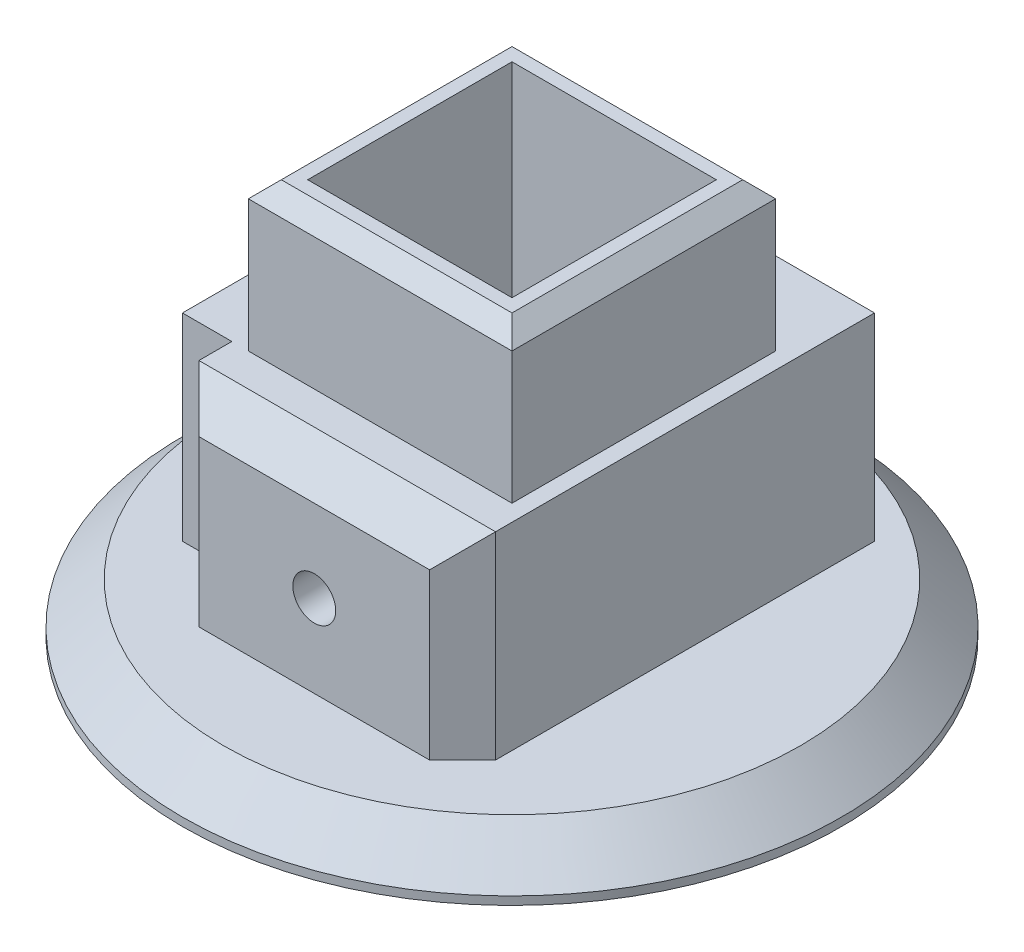
from build123d import *

# Parameters (mm, degrees)
SKETCH1_W               = 16
SKETCH1_H               = 16
BOSS_EXTRUDE1_DEPTH     = 24
SKETCH12_W              = 12.4
SKETCH12_H              = 12.4
CUT_EXTRUDE6_DEPTH      = 22
SKETCH13_R              = 20
BOSS_EXTRUDE2_DEPTH     = 3
CHAMFER1_SIZE           = 2.5
SKETCH14_W              = 16
SKETCH14_H              = 16
BOSS_EXTRUDE3_DEPTH     = 12
CUT_EXTRUDE1_DEPTH      = 7.5
CUT_EXTRUDE5_DEPTH      = 6.3
CUT_EXTRUDE5_DEPTH_BACK = 0.1
SKETCH11_W              = 4.2
SKETCH11_H              = 5.5
CHAMFER2_SIZE           = 2
CHAMFER4_SIZE           = 2
SKETCH15_R              = 1.3
CUT_EXTRUDE7_DEPTH      = 42.620307543
CHAMFER5_SIZE           = 1
ESQUISSE3_W             = 15.926523834
ESQUISSE3_H             = 12
BOSS_EXTRU_1_DEPTH      = 5
ENL_V_MAT_EXTRU_1_DEPTH = 7
ESQUISSE5_R             = 1.3
ENL_V_MAT_EXTRU_2_DEPTH = 5
CHANFREIN2_SIZE         = 2
CHANFREIN3_SIZE         = 2
CHANFREIN4_SIZE         = 2


with BuildPart() as part:
    # Sketch1 → Boss-Extrude1 (new body)
    with BuildSketch(Plane(origin=(0, 0, 0), x_dir=(1, 0, 0), z_dir=(0, 1, 0))):
        with Locations((0, 8)):
            Rectangle(SKETCH1_W, SKETCH1_H)
    extrude(amount=BOSS_EXTRUDE1_DEPTH)

    # Sketch12 → Cut-Extrude6 (cut)
    with BuildSketch(Plane(origin=(0, 24, 0), x_dir=(1, 0, 0), z_dir=(0, 1, 0))):
        with Locations((0, 8)):
            Rectangle(SKETCH12_W, SKETCH12_H)
    extrude(amount=-CUT_EXTRUDE6_DEPTH, mode=Mode.SUBTRACT)

    # Sketch13 → Boss-Extrude2 (add)
    with BuildSketch(Plane(origin=(0, 0, 0), x_dir=(1, 0, 0), z_dir=(0, 1, 0))):
        with Locations(Location((0, 8, 0), (0, 0, 270))):
            Circle(SKETCH13_R)
    extrude(amount=BOSS_EXTRUDE2_DEPTH)

    # Chamfer1
    chamfer1_edges = [part.edges().sort_by_distance(p)[0] for p in [
        (0, 3, -28),
    ]]
    chamfer(chamfer1_edges, length=CHAMFER1_SIZE)

    # Sketch14 → Boss-Extrude3 (add)
    with BuildSketch(Plane(origin=(0, 3, 0), x_dir=(1, 0, 0), z_dir=(0, 1, 0))):
        Polygon((-8, 23), (8, 23), (9, 23), (9, -4), (8, -4), (-8, -4), (-9, -4), (-9, 23), align=None)
        with Locations((0, 8)):
            Rectangle(SKETCH14_W, SKETCH14_H, mode=Mode.SUBTRACT)
    extrude(amount=BOSS_EXTRUDE3_DEPTH)

    # Sketch5 → Cut-Extrude1 (cut)
    with BuildSketch(Plane(origin=(0, 0, -23), x_dir=(-1, 0, 0), z_dir=(0, 0, -1))):
        with BuildLine():
            Line((-2.1, 11.1), (2.1, 11.1))
            Line((2.1, 11.1), (3.1, 10.1))
            Line((3.1, 10.1), (3.1, 8.8))
            ThreePointArc((3.1, 8.8), (3.9, 8), (3.1, 7.2))
            Line((3.1, 7.2), (3.1, 4.9))
            Line((3.1, 4.9), (-3.1, 4.9))
            Line((-3.1, 4.9), (-3.1, 7.2))
            ThreePointArc((-3.1, 7.2), (-3.9, 8), (-3.1, 8.8))
            Line((-3.1, 8.8), (-3.1, 10.1))
            Line((-3.1, 10.1), (-2.1, 11.1))
        make_face()
    extrude(amount=-CUT_EXTRUDE1_DEPTH, mode=Mode.SUBTRACT)

    # Sketch11 → Cut-Extrude5 (cut, two sides: drawn at the far end of the back side and taken through both)
    with BuildSketch(Plane.XZ.offset(-11.1).offset(-CUT_EXTRUDE5_DEPTH_BACK)):
        with Locations((0, -18.25)):
            Rectangle(SKETCH11_W, SKETCH11_H)
    extrude(amount=CUT_EXTRUDE5_DEPTH + CUT_EXTRUDE5_DEPTH_BACK, mode=Mode.SUBTRACT)

    # Chamfer2
    chamfer2_edges = [part.edges().sort_by_distance(p)[0] for p in [
        (0, 15, -23),
        (9, 9, -23),
        (-9, 9, -23),
    ]]
    chamfer(chamfer2_edges, length=CHAMFER2_SIZE)

    # Chamfer4
    chamfer4_edges = [part.edges().sort_by_distance(p)[0] for p in [
        (0, 15, 4),
        (-9, 9, 4),
        (9, 9, 4),
    ]]
    chamfer(chamfer4_edges, length=CHAMFER4_SIZE)

    # Sketch15 → Cut-Extrude7 (cut, through all)
    with BuildSketch(Plane(origin=(0, 0, -15.5), x_dir=(-1, 0, 0), z_dir=(0, 0, -1))):
        with Locations((0, 8)):
            Circle(SKETCH15_R)
    extrude(amount=-CUT_EXTRUDE7_DEPTH, mode=Mode.SUBTRACT)

    # Chamfer5
    chamfer5_edges = [part.edges().sort_by_distance(p)[0] for p in [
        (0, 24, -16),
        (-8, 24, -8),
        (0, 24, 0),
        (8, 24, -8),
    ]]
    chamfer(chamfer5_edges, length=CHAMFER5_SIZE)

    # Esquisse3 → Boss.-Extru.1 (add)
    with BuildSketch(Plane.ZY.offset(9)):
        with Locations((-7.963261917, 9)):
            Rectangle(ESQUISSE3_W, ESQUISSE3_H)
    extrude(amount=BOSS_EXTRU_1_DEPTH)

    # Esquisse4 → Enlèv. mat.-Extru.1 (cut)
    with BuildSketch(Plane.ZY.offset(14)):
        with BuildLine():
            Line((-10.065, 11.1), (-5.865, 11.1))
            Line((-5.865, 11.1), (-4.865, 10.1))
            Line((-4.865, 10.1), (-4.865, 8.8))
            ThreePointArc((-4.865, 8.8), (-4.065, 8), (-4.865, 7.2))
            Line((-4.865, 7.2), (-4.865, 4.9))
            Line((-4.865, 4.9), (-11.065, 4.9))
            Line((-11.065, 4.9), (-11.065, 7.2))
            ThreePointArc((-11.065, 7.2), (-11.865, 8), (-11.065, 8.8))
            Line((-11.065, 8.8), (-11.065, 10.1))
            Line((-11.065, 10.1), (-10.065, 11.1))
        make_face()
    extrude(amount=-ENL_V_MAT_EXTRU_1_DEPTH, mode=Mode.SUBTRACT)

    # Esquisse5 → Enlèv. mat.-Extru.2 (cut)
    with BuildSketch(Plane.ZY.offset(7)):
        with Locations((-7.965, 8)):
            Circle(ESQUISSE5_R)
    extrude(amount=-ENL_V_MAT_EXTRU_2_DEPTH, mode=Mode.SUBTRACT)

    # Chanfrein2
    chanfrein2_edges = [part.edges().sort_by_distance(p)[0] for p in [
        (-14, 15, -7.963261917),
    ]]
    chamfer(chanfrein2_edges, length=CHANFREIN2_SIZE)

    # Chanfrein3
    chanfrein3_edges = [part.edges().sort_by_distance(p)[0] for p in [
        (-14, 8, 0),
    ]]
    chamfer(chanfrein3_edges, length=CHANFREIN3_SIZE)

    # Chanfrein4
    chanfrein4_edges = [part.edges().sort_by_distance(p)[0] for p in [
        (-14, 8, -15.926523834),
    ]]
    chamfer(chanfrein4_edges, length=CHANFREIN4_SIZE)


solid = part.part
